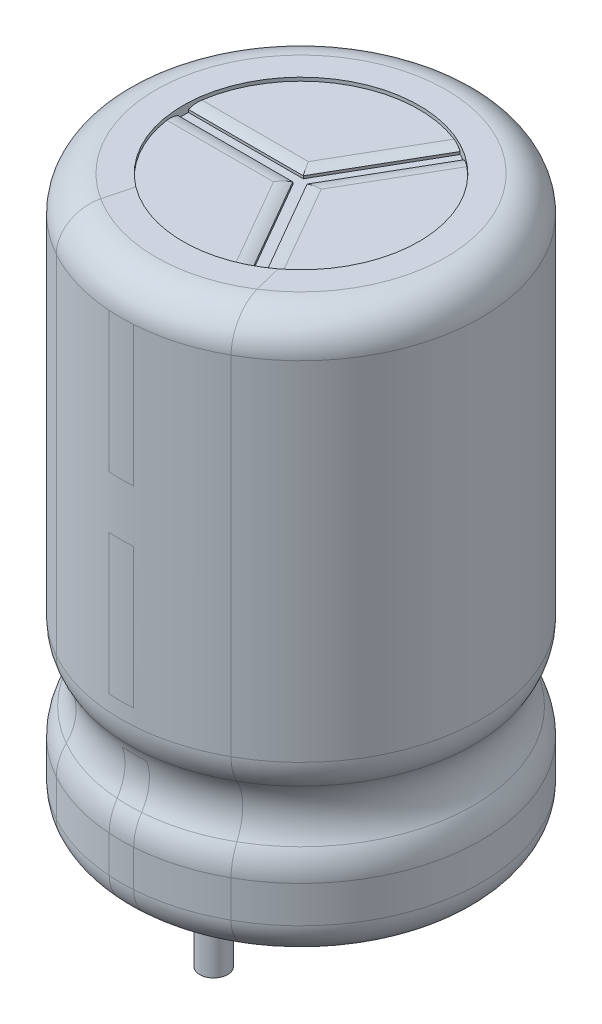
from build123d import *

# Parameters (mm, degrees)
SKETCH1_W           = 3.375
SKETCH1_H           = 1
CUT_EXTRUDE1_DEPTH  = 17.505188578
CIRPATTERN1_COUNT   = 3
SKETCH5_R           = 0.4
BOSS_EXTRUDE1_DEPTH = 2.5


with BuildPart() as part:
    # Sketch1 → Revolve1 (revolve)
    with BuildSketch(Plane(origin=(0, 0, 0), x_dir=(0, 0, -1), z_dir=(1, 0, 0))):
        with Locations((1.6875, 15.3)):
            Rectangle(SKETCH1_W, SKETCH1_H)
    revolve(axis=Axis((0, 33.37320456, 0), (0, -1, 0)))

    # Sketch2 → Cut-Extrude1 (cut, through all)
    with BuildSketch(Plane(origin=(0, 0, 0), x_dir=(0, 0, -1), z_dir=(1, 0, 0))):
        with BuildLine():
            Line((-0.5, 15.8), (0.5, 15.8))
            ThreePointArc((0.5, 15.8), (0.321027237, 15.781039562), (0.15, 15.725))
            Line((0.15, 15.725), (0.15, 15.65))
            Line((0.15, 15.65), (-0.15, 15.65))
            Line((-0.15, 15.65), (-0.15, 15.725))
            ThreePointArc((-0.15, 15.725), (-0.321027237, 15.781039562), (-0.5, 15.8))
        make_face()
    cut_extrude1 = extrude(amount=-CUT_EXTRUDE1_DEPTH, mode=Mode.SUBTRACT)

    # CirPattern1: Cut-Extrude1 ×3 about axis
    cirpattern1_axis = Axis((0, 33.37320456, 0), (0, 1, 0))
    for i in range(1, CIRPATTERN1_COUNT):
        add(cut_extrude1.rotate(cirpattern1_axis, i * 360 / CIRPATTERN1_COUNT), mode=Mode.SUBTRACT)

    # Sketch1<3> → Revolve2 (revolve)
    with BuildSketch(Plane(origin=(0, 0, 0), x_dir=(0, 0, -1), z_dir=(1, 0, 0))):
        with BuildLine():
            Line((3.375, 15.9), (3.375, 15.8))
            Line((3.375, 15.8), (3.375, 14.8))
            Line((3.375, 14.8), (0, 14.8))
            Line((0, 14.8), (0, 0))
            Line((0, 0), (4, 0))
            Line((4, 0), (4, -0.1))
            Line((4, -0.1), (4.15, -0.1))
            ThreePointArc((4.15, -0.1), (4.857106781, 0.192893219), (5.15, 0.9))
            Line((5.15, 0.9), (5.15, 1.95))
            ThreePointArc((5.15, 1.95), (5.092538314, 2.341511494), (4.925, 2.7))
            ThreePointArc((4.925, 2.7), (4.7, 3.45), (4.925, 4.2))
            ThreePointArc((4.925, 4.2), (5.092538314, 4.558488506), (5.15, 4.95))
            Line((5.15, 4.95), (5.15, 14.9))
            ThreePointArc((5.15, 14.9), (4.857106781, 15.607106781), (4.15, 15.9))
            Line((4.15, 15.9), (3.375, 15.9))
        make_face()
    revolve(axis=Axis((0, 33.37320456, 0), (0, -1, 0)))

    # Sketch5 → Boss-Extrude1 (add)
    with BuildSketch(Plane.XZ):
        with Locations((0, 2.5)):
            Circle(SKETCH5_R)
        with Locations((0, -2.5)):
            Circle(SKETCH5_R)
    extrude(amount=BOSS_EXTRUDE1_DEPTH)


solid = part.part
